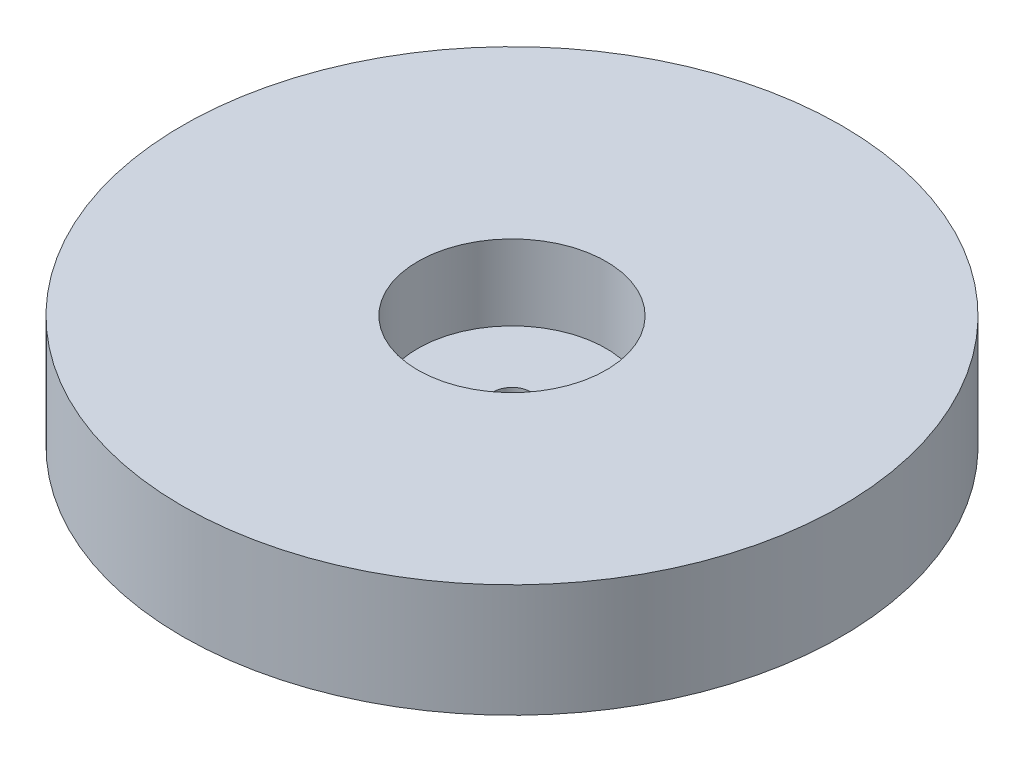
from build123d import *

# Parameters (mm, degrees)
ESQUISSE1_R             = 35
BOSS_EXTRU_1_DEPTH      = 12
ESQUISSE2_R             = 10
ENL_V_MAT_EXTRU_1_DEPTH = 8
ESQUISSE3_R             = 2
ENL_V_MAT_EXTRU_2_DEPTH = 8


with BuildPart() as part:
    # Esquisse1 → Boss.-Extru.1 (new body)
    with BuildSketch(Plane(origin=(0, 0, 0), x_dir=(1, 0, 0), z_dir=(0, 1, 0))):
        with Locations(Location((0, 0, 0), (0, 0, 270))):
            Circle(ESQUISSE1_R)
    extrude(amount=BOSS_EXTRU_1_DEPTH)

    # Esquisse2 → Enlèv. mat.-Extru.1 (cut)
    with BuildSketch(Plane(origin=(0, 12, 0), x_dir=(1, 0, 0), z_dir=(0, 1, 0))):
        with Locations(Location((0, 0, 0), (0, 0, 270))):
            Circle(ESQUISSE2_R)
    extrude(amount=-ENL_V_MAT_EXTRU_1_DEPTH, mode=Mode.SUBTRACT)

    # Esquisse3 → Enlèv. mat.-Extru.2 (cut)
    with BuildSketch(Plane(origin=(0, 4, 0), x_dir=(1, 0, 0), z_dir=(0, 1, 0))):
        with Locations(Location((0, 0, 0), (0, 0, 270))):
            Circle(ESQUISSE3_R)
    extrude(amount=-ENL_V_MAT_EXTRU_2_DEPTH, mode=Mode.SUBTRACT)


solid = part.part
